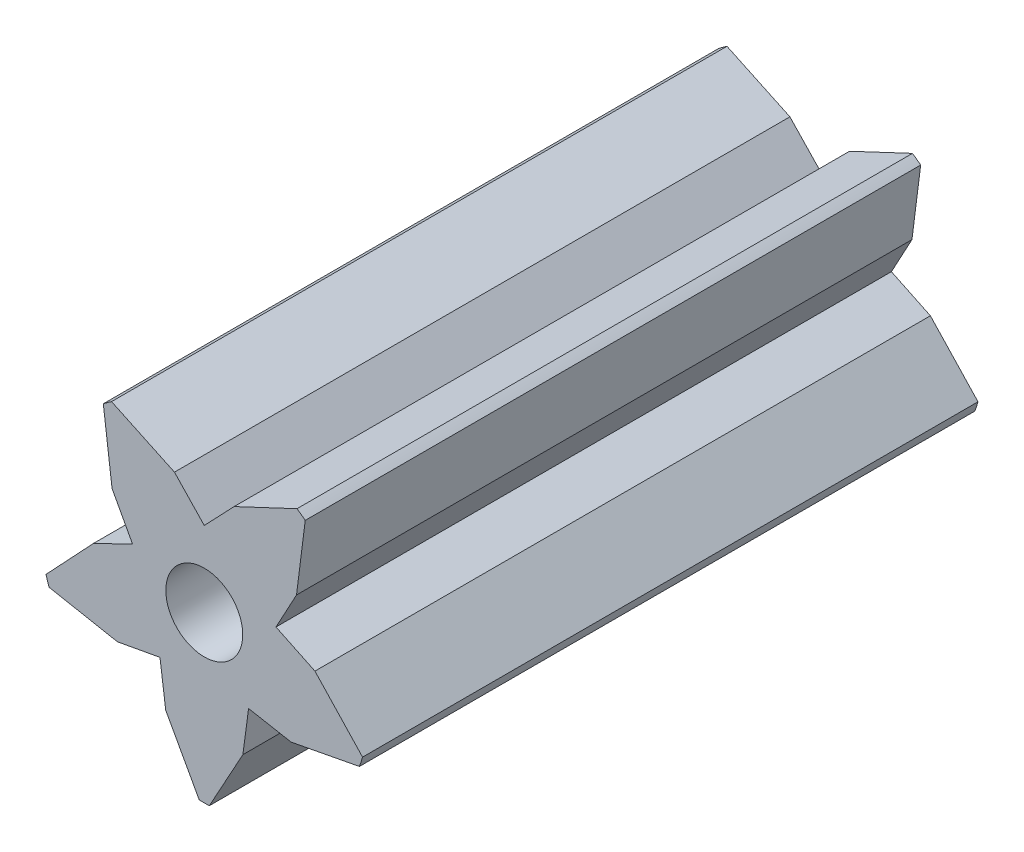
from build123d import *

# Parameters (mm, degrees)
SKETCH1_R           = 7.5
SKETCH1_R_2         = 1.75
BOSS_EXTRUDE1_DEPTH = 28
CUT_EXTRUDE1_DEPTH  = 30.941609843
CIRPATTERN1_COUNT   = 5


with BuildPart() as part:
    # Sketch1 → Boss-Extrude1 (new body)
    with BuildSketch(Plane.XY):
        Circle(SKETCH1_R)
        Circle(SKETCH1_R_2, mode=Mode.SUBTRACT)
    extrude(amount=BOSS_EXTRUDE1_DEPTH)

    # Sketch2 → Cut-Extrude1 (cut, through all)
    with BuildSketch(Plane.XY):
        Polygon((0, 3.429306859), (-1.35645876, 4.852854397), (-4.219139018, 6.200714954), (0, 11.25164702), (4.219139018, 6.200714954), (1.35645876, 4.852854397), align=None)
    cut_extrude1 = extrude(amount=CUT_EXTRUDE1_DEPTH, mode=Mode.SUBTRACT)

    # CirPattern1: Cut-Extrude1 ×5 about axis
    cirpattern1_axis = Axis((0, 0, 0), (0, 0, 1))
    for i in range(1, CIRPATTERN1_COUNT):
        add(cut_extrude1.rotate(cirpattern1_axis, i * 360 / CIRPATTERN1_COUNT), mode=Mode.SUBTRACT)


solid = part.part
